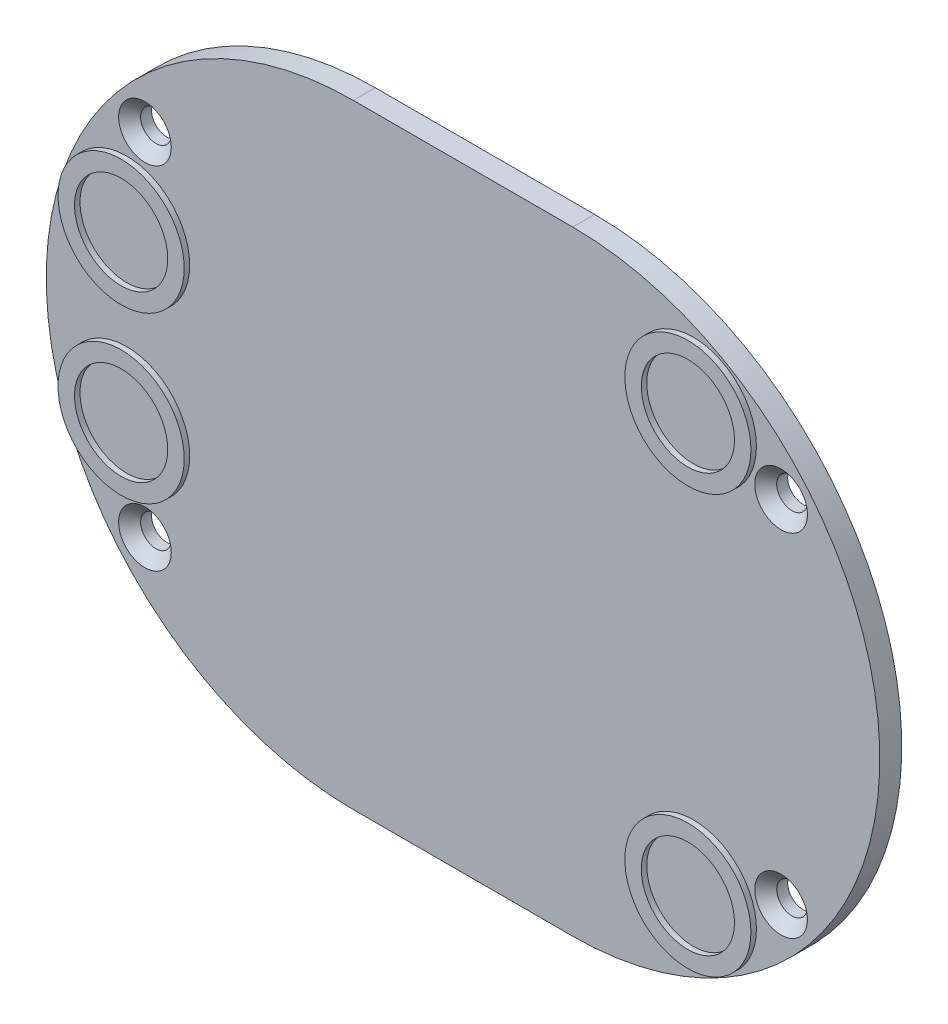
from build123d import *

# Parameters (mm, degrees)
EXTRUDE_2_DEPTH           = 2
HOLE_WIZARD_0_D           = 2.8
HOLE_WIZARD_0_DEPTH       = 10.1
HOLE_WIZARD_0_CSINK_D     = 4.8
HOLE_WIZARD_0_CSINK_ANGLE = 90
HOLE_WIZARD_0_TIP         = 0.841204867
SKETCH_7_R                = 5.75
SKETCH_7_R_2              = 4.25
EXTRUDE_1_DEPTH           = 0.5


with BuildPart() as part:
    # 草图3 → 凸台-拉伸2 (new body)
    with BuildSketch(Plane.XY):
        with BuildLine():
            Line((10, -28), (-10, -28))
            ThreePointArc((-10, -28), (-38, 0), (-10, 28))
            Line((-10, 28), (10, 28))
            ThreePointArc((10, 28), (38, 0), (10, -28))
        make_face()
    extrude(amount=EXTRUDE_2_DEPTH)

    # 打孔尺寸(%根据十字)槽沉头自攻螺钉的类型0
    with Locations(Plane.XY.offset(2)):
        with Locations((-29, 16), (-29, -16), (29, 16), (29, -16)):
            CounterSinkHole(HOLE_WIZARD_0_D / 2, HOLE_WIZARD_0_CSINK_D / 2, depth=HOLE_WIZARD_0_DEPTH, counter_sink_angle=HOLE_WIZARD_0_CSINK_ANGLE)
            with Locations((0, 0, -(HOLE_WIZARD_0_DEPTH + HOLE_WIZARD_0_TIP / 2))):  # 118° drill point
                Cone(0, HOLE_WIZARD_0_D / 2, HOLE_WIZARD_0_TIP, mode=Mode.SUBTRACT)

    # 草图7 → 拉伸-薄壁1 (add)
    # profile 1 of 4: a face of its own
    with BuildSketch(Plane.XY.offset(2)):
        with Locations((-30.673237657, 7.524443153)):
            Circle(SKETCH_7_R)
        with Locations((-30.673237657, 7.524443153)):
            Circle(SKETCH_7_R_2, mode=Mode.SUBTRACT)
    # profile 2 of 4: a face of its own
    with BuildSketch(Plane.XY.offset(2)):
        with Locations((-30.673237657, -7.524443153)):
            Circle(SKETCH_7_R)
        with Locations((-30.673237657, -7.524443153)):
            Circle(SKETCH_7_R_2, mode=Mode.SUBTRACT)
    # profile 3 of 4: a face of its own
    with BuildSketch(Plane.XY.offset(2)):
        with Locations((21, -19.052558883)):
            Circle(SKETCH_7_R)
        with Locations((21, -19.052558883)):
            Circle(SKETCH_7_R_2, mode=Mode.SUBTRACT)
    # profile 4 of 4: a face of its own
    with BuildSketch(Plane.XY.offset(2)):
        with Locations((21, 19.052558883)):
            Circle(SKETCH_7_R)
        with Locations((21, 19.052558883)):
            Circle(SKETCH_7_R_2, mode=Mode.SUBTRACT)
    extrude(amount=EXTRUDE_1_DEPTH)


solid = part.part
